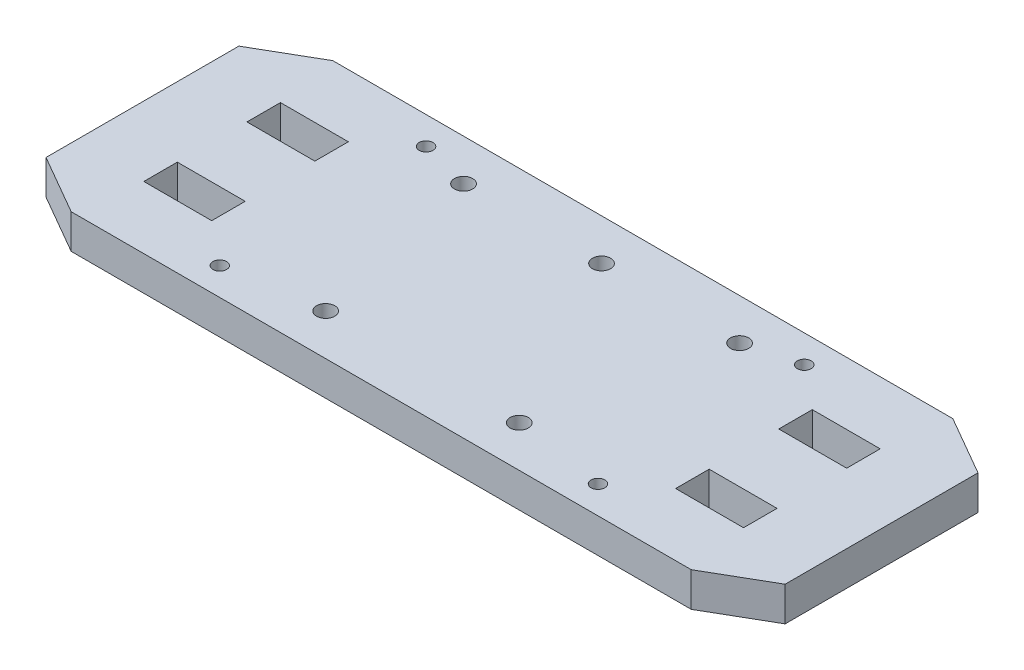
from build123d import *
from OCP.BRepFilletAPI import BRepFilletAPI_MakeChamfer

# Parameters (mm, degrees)
SKETCH1_W           = 215
SKETCH1_H           = 76.1
SKETCH1_R           = 2.65
BOSS_EXTRUDE1_DEPTH = 10
SKETCH2_W           = 19.75
SKETCH2_H           = 9.75
CUT_EXTRUDE1_DEPTH  = 115.472933482
CHAMFER1_SIZE       = 10
CHAMFER1_SIZE2      = 17.320508076
SKETCH3_R           = 2
CUT_EXTRUDE2_DEPTH  = 115.472933482


with BuildPart() as part:
    # Sketch1 → Boss-Extrude1 (new body)
    with BuildSketch(Plane(origin=(0, 0, 0), x_dir=(1, 0, 0), z_dir=(0, 1, 0))):
        Rectangle(SKETCH1_W, SKETCH1_H)
        with Locations(Location((-40.15, 26.05, 0), (0, 0, 270))):
            Circle(SKETCH1_R, mode=Mode.SUBTRACT)
        with Locations(Location((40.15, 26.05, 0), (0, 0, 90))):
            Circle(SKETCH1_R, mode=Mode.SUBTRACT)
        with Locations(Location((0, 26.05, 0), (0, 0, 270))):
            Circle(SKETCH1_R, mode=Mode.SUBTRACT)
        with Locations(Location((-28.15, -26.05, 0), (0, 0, 270))):
            Circle(SKETCH1_R, mode=Mode.SUBTRACT)
        with Locations(Location((28.15, -26.05, 0), (0, 0, 90))):
            Circle(SKETCH1_R, mode=Mode.SUBTRACT)
    extrude(amount=BOSS_EXTRUDE1_DEPTH)

    # Sketch2 → Cut-Extrude1 (cut, through all)
    with BuildSketch(Plane(origin=(0, 10, 0), x_dir=(1, 0, 0), z_dir=(0, 1, 0))):
        with Locations((-77.35, -15)):
            Rectangle(SKETCH2_W, SKETCH2_H)
        with Locations((-77.35, 15)):
            Rectangle(SKETCH2_W, SKETCH2_H)
        with Locations((77.35, 15)):
            Rectangle(SKETCH2_W, SKETCH2_H)
        with Locations((77.35, -15)):
            Rectangle(SKETCH2_W, SKETCH2_H)
    extrude(amount=-CUT_EXTRUDE1_DEPTH, mode=Mode.SUBTRACT)

    # Chamfer1: one chamfer whose edges measure the first distance from different faces: ONE call of the kernel's chamfer builder (chamfer() names one face for all edges)
    chamfer1_edges_1 = [part.edges().sort_by_distance(p)[0] for p in [
        (-107.5, 5, -38.05),
        (-107.5, 5, 38.05),
    ]]
    chamfer1_side_1 = [part.faces().sort_by_distance(p)[0] for p in [
        (-107.5, 5, 0),
    ]]
    chamfer1_edges_2 = [part.edges().sort_by_distance(p)[0] for p in [
        (107.5, 5, -38.05),
        (107.5, 5, 38.05),
    ]]
    chamfer1_side_2 = [part.faces().sort_by_distance(p)[0] for p in [
        (107.5, 5, 0),
    ]]
    chamfer1 = BRepFilletAPI_MakeChamfer(part.part.solid().wrapped)
    for e in chamfer1_edges_1:
        chamfer1.Add(CHAMFER1_SIZE, CHAMFER1_SIZE2, e.wrapped, chamfer1_side_1[0].wrapped)  # the first distance lies on this face
    for e in chamfer1_edges_2:
        chamfer1.Add(CHAMFER1_SIZE, CHAMFER1_SIZE2, e.wrapped, chamfer1_side_2[0].wrapped)  # the first distance lies on this face
    add(Compound.cast(chamfer1.Shape()), mode=Mode.REPLACE)

    # Sketch3 → Cut-Extrude2 (cut, through all)
    with BuildSketch(Plane(origin=(0, 10, 0), x_dir=(1, 0, 0), z_dir=(0, 1, 0))):
        with Locations(Location((-55, -30, 0), (0, 0, 270))):
            Circle(SKETCH3_R)
        with Locations(Location((-55, 30, 0), (0, 0, 90))):
            Circle(SKETCH3_R)
        with Locations(Location((55, -30, 0), (0, 0, 90))):
            Circle(SKETCH3_R)
        with Locations(Location((55, 30, 0), (0, 0, 270))):
            Circle(SKETCH3_R)
    extrude(amount=-CUT_EXTRUDE2_DEPTH, mode=Mode.SUBTRACT)


solid = part.part
